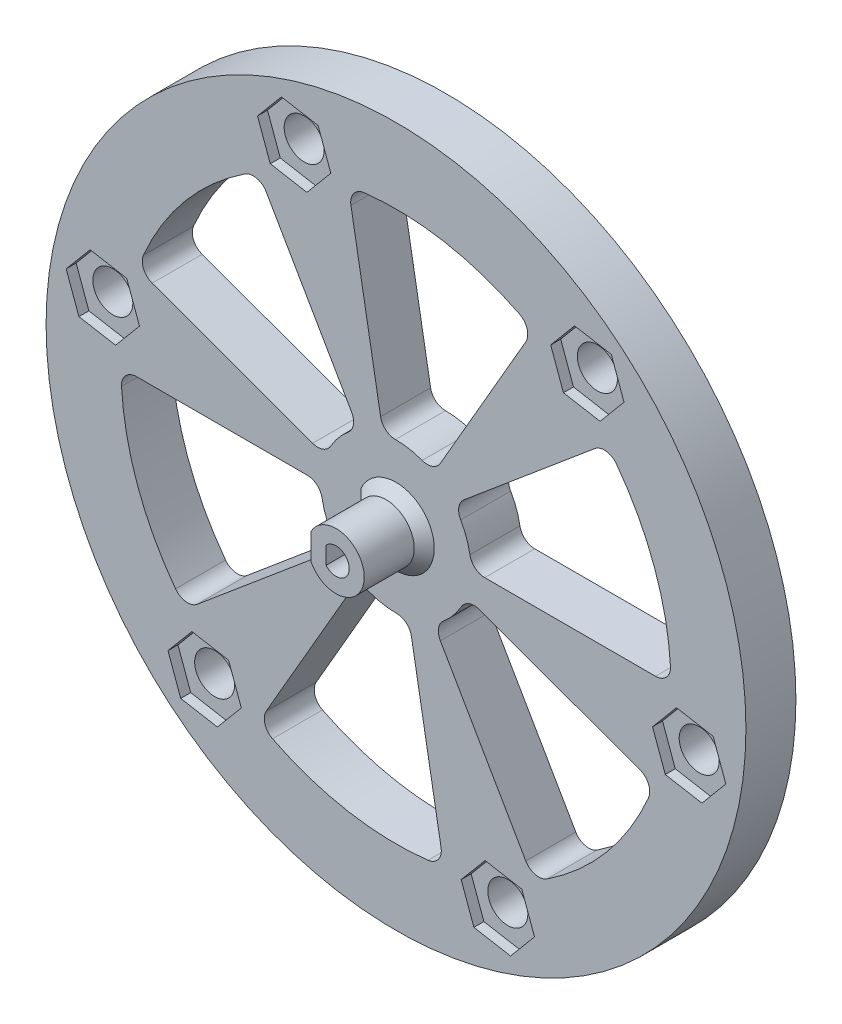
from build123d import *

# Parameters (mm, degrees)
ESQUISSE1_R                        = 70
BOSS_EXTRU_1_DEPTH                 = 10
ENL_V_MAT_EXTRU_1_DEPTH            = 100.498743711
BOSS_EXTRU_2_START                 = 12
BOSS_EXTRU_2_DEPTH                 = 12
ENL_V_MAT_EXTRU_2_REACH            = 106.924
ESQUISSE4_R                        = 1.5
CHANFREIN1_SIZE                    = 2
ENL_V_MAT_EXTRU_3_REACH            = 101.72
CONG_1_R                           = 3
ENL_V_MAT_EXTRU_4_DEPTH            = 2
ENL_V_MAT_EXTRU_5_REACH            = 101.98
ESQUISSE8_R                        = 4
R_P_TITION_CIRCULAIRE1_COUNT       = 6
CONG_1_OF_R_P_TITION_CIRCULAIRE1_R = 3


with BuildPart() as part:
    # Esquisse1 → Boss.-Extru.1 (new body)
    with BuildSketch(Plane.XY):
        Circle(ESQUISSE1_R)
    extrude(amount=BOSS_EXTRU_1_DEPTH)

    # Esquisse2 → Enlèv. mat.-Extru.1 (cut, through all)
    with BuildSketch(Plane.XY.offset(10)):
        with BuildLine():
            Line((-2, 1.738533865), (-2, -1.738533865))
            ThreePointArc((-2, -1.738533865), (2.65, 0), (-2, 1.738533865))
        make_face()
    extrude(amount=-ENL_V_MAT_EXTRU_1_DEPTH, mode=Mode.SUBTRACT)

    # Esquisse3 → Boss.-Extru.2 (add)
    with BuildSketch(Plane.XY.offset(10).offset(BOSS_EXTRU_2_START)):
        with BuildLine():
            Line((-5, 2.631064423), (-5, -2.631064423))
            ThreePointArc((-5, -2.631064423), (5.65, 0), (-5, 2.631064423))
        make_face()
        with BuildLine():
            Line((-2, 1.738533865), (-2, -1.738533865))
            ThreePointArc((-2, -1.738533865), (2.65, 0), (-2, 1.738533865))
        make_face(mode=Mode.SUBTRACT)
    extrude(amount=-BOSS_EXTRU_2_DEPTH)

    # Esquisse4 → Enlèv. mat.-Extru.2 (cut, up to next)
    with BuildSketch(Plane.ZY.offset(5), mode=Mode.PRIVATE) as enl_v_mat_extru_2_sk1:
        with Locations((16, 0)):
            Circle(ESQUISSE4_R)
    enl_v_mat_extru_2_tool1 = extrude(enl_v_mat_extru_2_sk1.sketch, amount=-ENL_V_MAT_EXTRU_2_REACH, mode=Mode.PRIVATE) & part.part
    add(enl_v_mat_extru_2_tool1.solids().sort_by_distance((-5, 0, 16))[0], mode=Mode.SUBTRACT)

    # Chanfrein1
    chanfrein1_edges = [part.edges().sort_by_distance(p)[0] for p in [
        (-5, 0, 10),
        (5.65, 0, 10),
    ]]
    chamfer(chanfrein1_edges, length=CHANFREIN1_SIZE)

    # Esquisse5 → Enlèv. mat.-Extru.3 (cut, up to next)
    with BuildSketch(Plane.XY.offset(10), mode=Mode.PRIVATE) as enl_v_mat_extru_3_sk1:
        with BuildLine():
            Line((14.095389312, -5.13030215), (51.683094143, -18.811107883))
            ThreePointArc((51.683094143, -18.811107883), (42.132444372, -35.353318533), (27.5, -47.631397208))
            Line((27.5, -47.631397208), (7.5, -12.990381057))
            ThreePointArc((7.5, -12.990381057), (11.490666647, -9.641814145), (14.095389312, -5.13030215))
        make_face()
    enl_v_mat_extru_3_tool1 = extrude(enl_v_mat_extru_3_sk1.sketch, amount=-ENL_V_MAT_EXTRU_3_REACH, mode=Mode.PRIVATE) & part.part
    enl_v_mat_extru_3 = enl_v_mat_extru_3_tool1.solids().sort_by_distance((29.12974, -24.442754, 10))[0]
    add(enl_v_mat_extru_3, mode=Mode.SUBTRACT)

    # Congé1
    cong_1_edges = [part.edges().sort_by_distance(p)[0] for p in [
        (27.5, -47.631397208, 5),
        (51.683094143, -18.811107883, 5),
        (7.5, -12.990381057, 5),
        (14.095389312, -5.13030215, 5),
    ]]
    fillet(cong_1_edges, radius=CONG_1_R)

    # Esquisse7 → Enlèv. mat.-Extru.4 (cut)
    with BuildSketch(Plane.XY.offset(10)):
        Polygon((65.982119452, -11.634427904), (63.43481551, -4.635767844), (56.100146136, -3.342467739), (51.312780702, -9.047827693), (53.860084644, -16.046487753), (61.194754018, -17.339787858), align=None)
    enl_v_mat_extru_4 = extrude(amount=-ENL_V_MAT_EXTRU_4_DEPTH, mode=Mode.SUBTRACT)

    # Esquisse8 → Enlèv. mat.-Extru.5 (cut, up to next)
    with BuildSketch(Plane.XY.offset(8), mode=Mode.PRIVATE) as enl_v_mat_extru_5_sk1:
        with Locations((58.647450077, -10.341127798)):
            Circle(ESQUISSE8_R)
    enl_v_mat_extru_5_tool1 = extrude(enl_v_mat_extru_5_sk1.sketch, amount=-ENL_V_MAT_EXTRU_5_REACH, mode=Mode.PRIVATE) & part.part
    enl_v_mat_extru_5 = enl_v_mat_extru_5_tool1.solids().sort_by_distance((58.64745, -10.341128, 8))[0]
    add(enl_v_mat_extru_5, mode=Mode.SUBTRACT)

    # Répétition circulaire1: Enlèv. mat.-Extru.3, Enlèv. mat.-Extru.4, Enlèv. mat.-Extru.5 ×6 about axis
    r_p_tition_circulaire1_axis = Axis((0, 0, -0.8), (0, 0, 1))
    add([enl_v_mat_extru_3.rotate(r_p_tition_circulaire1_axis, i * 360 / R_P_TITION_CIRCULAIRE1_COUNT) for i in range(1, R_P_TITION_CIRCULAIRE1_COUNT)], mode=Mode.SUBTRACT)
    add([enl_v_mat_extru_4.rotate(r_p_tition_circulaire1_axis, i * 360 / R_P_TITION_CIRCULAIRE1_COUNT) for i in range(1, R_P_TITION_CIRCULAIRE1_COUNT)], mode=Mode.SUBTRACT)
    add([enl_v_mat_extru_5.rotate(r_p_tition_circulaire1_axis, i * 360 / R_P_TITION_CIRCULAIRE1_COUNT) for i in range(1, R_P_TITION_CIRCULAIRE1_COUNT)], mode=Mode.SUBTRACT)

    # Congé1 of Répétition circulaire1
    cong_1_of_r_p_tition_circulaire1_edges = [part.edges().sort_by_distance(p)[0] for p in [
        (55, 0, 5),
        (42.132444372, 35.353318533, 5),
        (15, 0, 5),
        (11.490666647, 9.641814145, 5),
        (27.5, 47.631397208, 5),
        (-9.550649772, 54.164426416, 5),
        (7.5, 12.990381057, 5),
        (-2.604722665, 14.772116295, 5),
        (-27.5, 47.631397208, 5),
        (-51.683094143, 18.811107883, 5),
        (-7.5, 12.990381057, 5),
        (-14.095389312, 5.13030215, 5),
        (-55, 0, 5),
        (-42.132444372, -35.353318533, 5),
        (-15, 0, 5),
        (-11.490666647, -9.641814145, 5),
        (-27.5, -47.631397208, 5),
        (9.550649772, -54.164426416, 5),
        (-7.5, -12.990381057, 5),
        (2.604722665, -14.772116295, 5),
    ]]
    fillet(cong_1_of_r_p_tition_circulaire1_edges, radius=CONG_1_OF_R_P_TITION_CIRCULAIRE1_R)


solid = part.part
